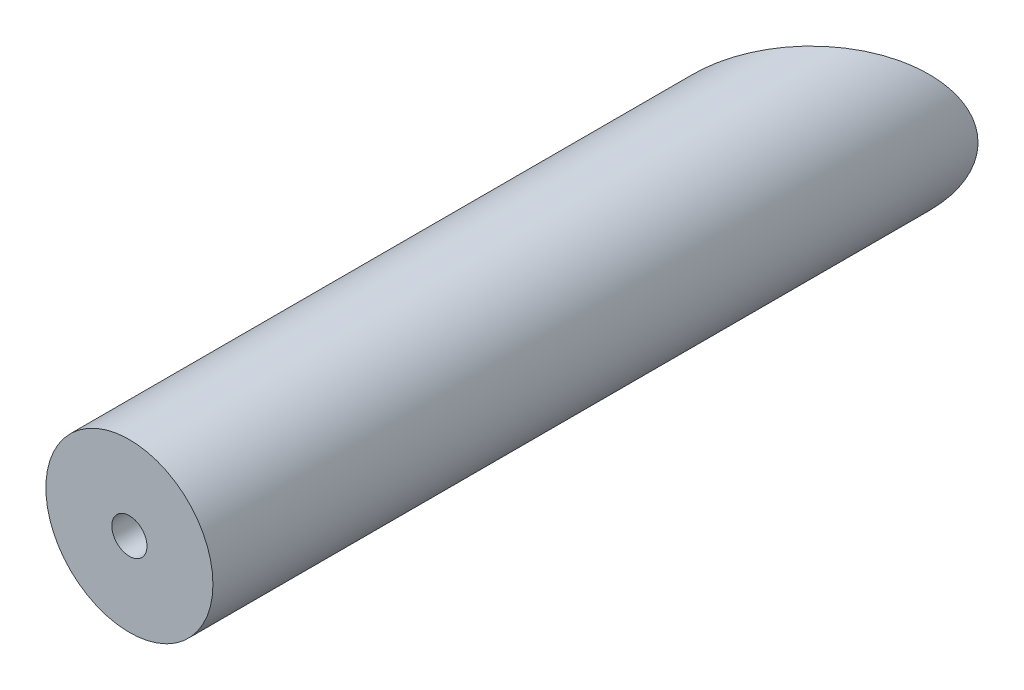
from build123d import *

# Parameters (mm, degrees)
SKETCH1_R               = 30.1625
SKETCH1_R_2             = 6.35
BOSS_EXTRUDE1_DEPTH     = 276.225
CUT_EXTRUDE1_DEPTH      = 280.499201139
CUT_EXTRUDE1_DEPTH_BACK = 280.499201139


with BuildPart() as part:
    # Sketch1 → Boss-Extrude1 (new body)
    with BuildSketch(Plane.XY):
        Circle(SKETCH1_R)
        Circle(SKETCH1_R_2, mode=Mode.SUBTRACT)
    extrude(amount=BOSS_EXTRUDE1_DEPTH)

    # Sketch2 → Cut-Extrude1 (cut, two sides: drawn at the far end of the back side and taken through both)
    with BuildSketch(Plane(origin=(0, 0, 0), x_dir=(1, 0, 0), z_dir=(0, 1, 0)).offset(-CUT_EXTRUDE1_DEPTH_BACK)):
        Polygon((30.1625, 0), (-40.140281567, -70.302781567), (-40.140281567, 5.464682821), (30.1625, 5.464682821), align=None)
    extrude(amount=CUT_EXTRUDE1_DEPTH + CUT_EXTRUDE1_DEPTH_BACK, mode=Mode.SUBTRACT)


solid = part.part
